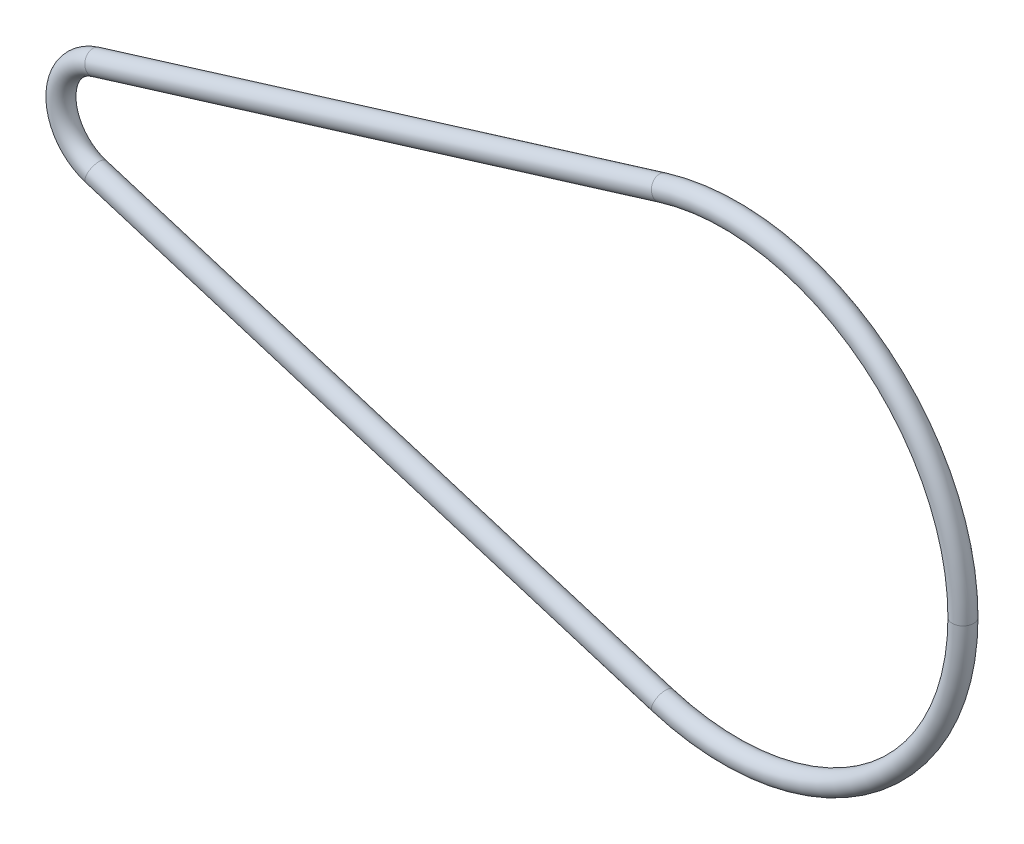
from build123d import *

# Parameters (mm, degrees)
SKETCH2_R = 0.762


with BuildPart() as part:
    # Sweep1: sweep along a path in Sketch1
    with BuildLine(Plane.XY) as sweep1_path:
        Line((-45.272234286, 2.670274664), (-4.671785714, 15.172015134))
        ThreePointArc((-4.671785714, 15.172015134), (15.875, 0), (-4.671785714, -15.172015134))
        Line((-4.671785714, -15.172015134), (-45.272234286, -2.670274664))
        ThreePointArc((-45.272234286, -2.670274664), (-47.244, 0), (-45.272234286, 2.670274664))
    # Sketch2 → Sweep1 (sweep)
    with BuildSketch(Plane(origin=(0, 0, 0), x_dir=(1, 0, 0), z_dir=(0, 1, 0))):
        with Locations((16.637, 0)):
            Circle(SKETCH2_R)
    sweep(path=sweep1_path.line)


solid = part.part
